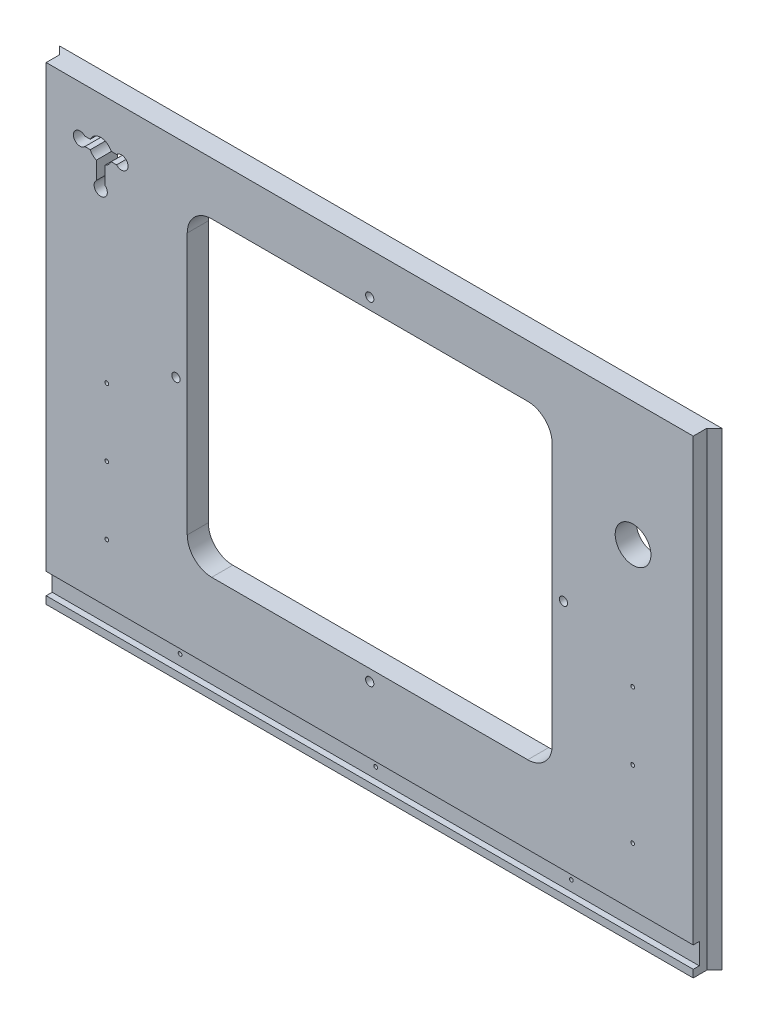
from build123d import *

# Parameters (mm, degrees)
SKETCH2_W          = 558.8
SKETCH2_H          = 396.08125
EXTRUDE1_DEPTH     = 17.78
SKETCH3_R          = 15.08125
SKETCH3_R_2        = 3.4925
SKETCH3_R_3        = 1.5875
SKETCH3_W          = 308.0004
SKETCH3_H          = 261.9629
CUT_EXTRUDE1_DEPTH = 17.78
CUT_EXTRUDE2_DEPTH = 5.08
CUT_EXTRUDE4_DEPTH = 396.08125
FILLET1_R          = 20.6502


with BuildPart() as part:
    # Sketch2 → Extrude1 (new body)
    with BuildSketch(Plane.XY):
        with Locations((11975.041666666, -5854.303125)):
            Rectangle(SKETCH2_W, SKETCH2_H)
    extrude(amount=-EXTRUDE1_DEPTH)

    # Sketch3 → Cut-Extrude1 (cut)
    with BuildSketch(Plane.XY):
        with Locations((12197.291666666, -5761.0375)):
            Circle(SKETCH3_R)
        with Locations((12138.554166666, -5831.68125)):
            Circle(SKETCH3_R_2)
        with Locations((12196.974166666, -5865.01875)):
            Circle(SKETCH3_R_3)
        with Locations((12196.974166666, -5922.16875)):
            Circle(SKETCH3_R_3)
        with Locations((12196.974166666, -5979.31875)):
            Circle(SKETCH3_R_3)
        with Locations((12140.141666666, -6037.10375)):
            Circle(SKETCH3_R_3)
        with Locations((11975.041666666, -6037.10375)):
            Circle(SKETCH3_R_3)
        with Locations((11809.941666666, -6037.10375)):
            Circle(SKETCH3_R_3)
        with Locations((11753.109166666, -5979.31875)):
            Circle(SKETCH3_R_3)
        with Locations((11753.109166666, -5922.16875)):
            Circle(SKETCH3_R_3)
        with Locations((11753.109166666, -5865.01875)):
            Circle(SKETCH3_R_3)
        with Locations((11811.529166666, -5831.68125)):
            Circle(SKETCH3_R_2)
        with Locations((11975.041666666, -5972.175)):
            Circle(SKETCH3_R_2)
        with Locations((11975.041666666, -5691.1875)):
            Circle(SKETCH3_R_2)
        with Locations((11975.041666666, -5831.68125)):
            Rectangle(SKETCH3_W, SKETCH3_H)
        with BuildLine():
            Line((11734.654409808, -5693.754968556), (11739.23011943, -5693.754968556))
            ThreePointArc((11739.23011943, -5693.754968556), (11748.029166666, -5687.976468556), (11756.828213901, -5693.754968556))
            Line((11756.828213901, -5693.754968556), (11761.386355753, -5693.754968556))
            ThreePointArc((11761.386355753, -5693.754968556), (11767.531113043, -5692.357368906), (11771.079666666, -5697.564968556))
            ThreePointArc((11771.079666666, -5697.564968556), (11767.531113043, -5702.772568206), (11761.386355753, -5701.374968556))
            Line((11761.386355753, -5701.374968556), (11756.828213901, -5701.374968556))
            ThreePointArc((11756.828213901, -5701.374968556), (11754.760305425, -5704.393665595), (11751.712166666, -5706.417925308))
            Line((11751.712166666, -5706.417925308), (11751.712166666, -5721.30243896))
            ThreePointArc((11751.712166666, -5721.30243896), (11748.029166666, -5731.092968556), (11744.346166666, -5721.30243896))
            Line((11744.346166666, -5721.30243896), (11744.346166666, -5706.417925308))
            ThreePointArc((11744.346166666, -5706.417925308), (11741.298027907, -5704.393665595), (11739.23011943, -5701.374968556))
            Line((11739.23011943, -5701.374968556), (11734.654409809, -5701.374968556))
            ThreePointArc((11734.654409809, -5701.374968556), (11724.978666666, -5697.564968556), (11734.654409808, -5693.754968556))
        make_face()
    extrude(amount=-CUT_EXTRUDE1_DEPTH, mode=Mode.SUBTRACT)

    # Sketch4 → Cut-Extrude2 (cut)
    with BuildSketch(Plane.XY):
        Polygon((11975.041666666, -6028.21375), (11695.641666666, -6028.21375), (11695.641666666, -6045.99375), (12254.441666666, -6045.99375), (12254.441666666, -6028.21375), align=None)
    extrude(amount=-CUT_EXTRUDE2_DEPTH, mode=Mode.SUBTRACT)

    # Sketch7 → Cut-Extrude4 (cut)
    with BuildSketch(Plane.XZ.offset(6052.34375)):
        Polygon((11701.991666666, -11.43), (11701.991666666, 0), (11695.641666666, 0), (11695.641666666, -17.78), align=None)
        Polygon((12248.091666666, -11.43), (12254.441666666, -17.78), (12254.441666666, 0), (12248.091666666, 0), align=None)
    extrude(amount=-CUT_EXTRUDE4_DEPTH, mode=Mode.SUBTRACT)

    # Fillet1
    fillet1_edges = [part.edges().sort_by_distance(p)[0] for p in [
        (11821.041466666, -5962.6627, -8.89),
        (11821.041466666, -5700.6998, -8.89),
        (12129.041866666, -5700.6998, -8.89),
        (12129.041866666, -5962.6627, -8.89),
    ]]
    fillet(fillet1_edges, radius=FILLET1_R)


solid = part.part
